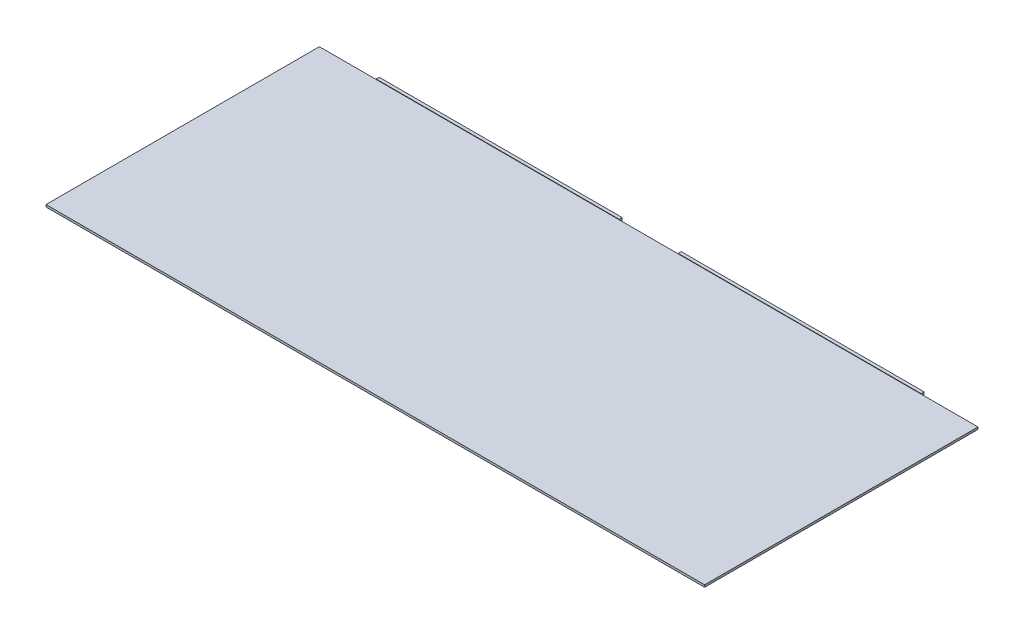
from build123d import *

# Parameters (mm, degrees)
SKETCH1_W           = 688.4416
SKETCH1_H           = 285.75
BOSS_EXTRUDE1_DEPTH = 1.143
SKETCH2_W           = 254
SKETCH2_H           = 2.7305
BOSS_EXTRUDE2_DEPTH = 3.175


with BuildPart() as part:
    # Sketch1 → Boss-Extrude1 (new, symmetric)
    with BuildSketch(Plane(origin=(0, 0, 0), x_dir=(1, 0, 0), z_dir=(0, 1, 0))):
        Rectangle(SKETCH1_W, SKETCH1_H)
    extrude(amount=BOSS_EXTRUDE1_DEPTH, both=True)

    # Sketch2 → Boss-Extrude2 (add)
    with BuildSketch(Plane(origin=(0, 0, -142.875), x_dir=(-1, 0, 0), z_dir=(0, 0, -1))):
        with Locations((-157.8229, 0.22225)):
            Rectangle(SKETCH2_W, SKETCH2_H)
        with Locations((157.8229, 0.22225)):
            Rectangle(SKETCH2_W, SKETCH2_H)
    extrude(amount=BOSS_EXTRUDE2_DEPTH)


solid = part.part
